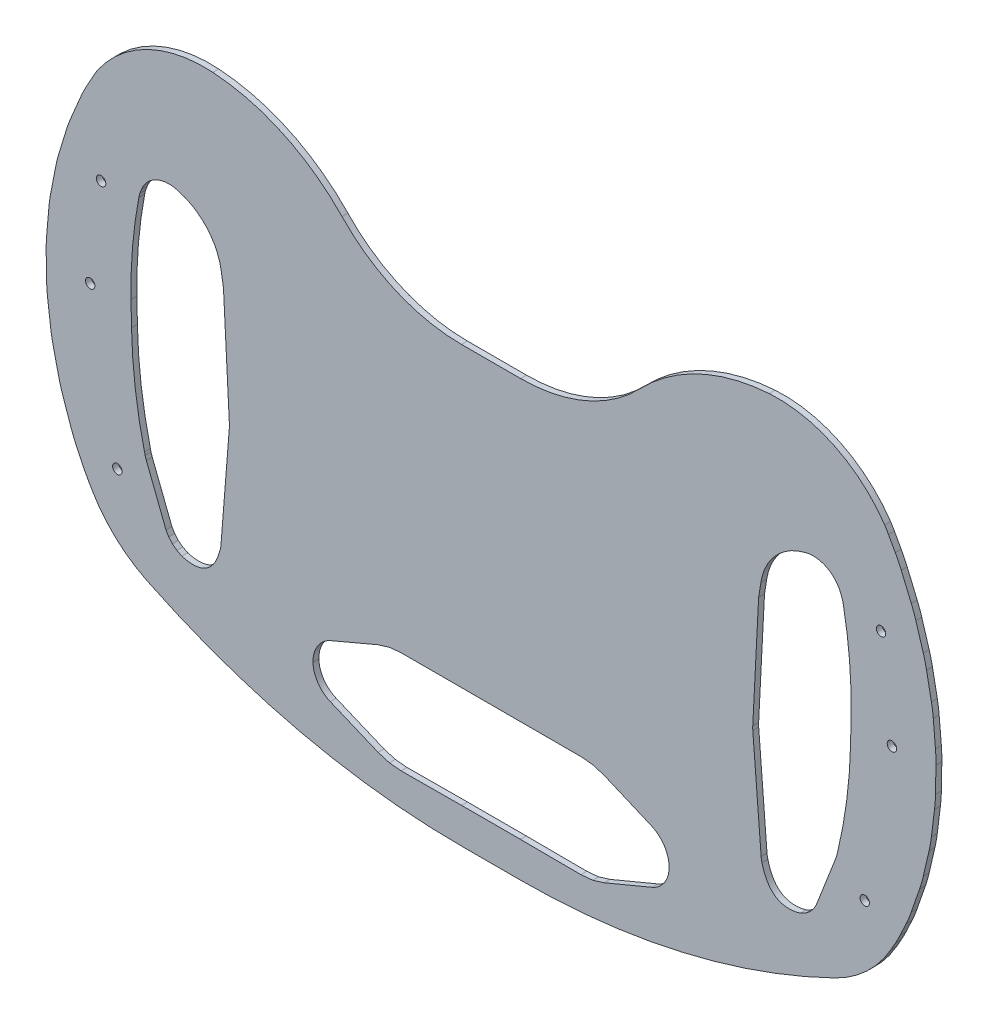
from build123d import *

# Parameters (mm, degrees)
SKETCH1_R           = 1.600004733
SKETCH1_R_2         = 1.600008458
SKETCH1_R_3         = 1.600001007
BOSS_EXTRUDE1_DEPTH = 2


with BuildPart() as part:
    # Sketch1 → Boss-Extrude1 (new body)
    with BuildSketch(Plane(origin=(0, 0, 3.49999997), x_dir=(-1, 0, 0), z_dir=(0, 0, -1))):
        with BuildLine():
            Line((-20, -102.64135196), (0, -102.64135196))
            ThreePointArc((0, -102.64135196), (54.826762958, -96.402803145), (106.850367414, -78.006118468))
            ThreePointArc((106.850367414, -78.006118468), (117.721514816, -70.507303457), (125.877694674, -60.120253705))
            Line((125.877694674, -60.120253705), (127.430048958, -57.377443185))
            ThreePointArc((127.430048958, -57.377443185), (128.246970558, -55.865942841), (129.004258673, -54.323701322))
            Line((129.004258673, -54.323701322), (131.011852014, -50.025012538))
            ThreePointArc((131.011852014, -50.025012538), (131.934514731, -47.905941493), (132.744632644, -45.741345098))
            Line((132.744632644, -45.741345098), (135.592695073, -37.476432501))
            ThreePointArc((135.592695073, -37.476432501), (136.284091675, -35.286016159), (136.86023823, -33.062503586))
            Line((136.86023823, -33.062503586), (138.815821901, -24.612835894))
            ThreePointArc((138.815821901, -24.612835894), (139.275226116, -22.361847038), (139.61651234, -20.089947662))
            Line((139.61651234, -20.089947662), (140.680309789, -11.484569813))
            ThreePointArc((140.680309789, -11.484569813), (140.902861597, -9.193521368), (141.005295113, -6.893969312))
            Line((141.005295113, -6.893969312), (141.164836348, 1.796846962))
            ThreePointArc((141.164836348, 1.796846962), (141.146870605, 4.098627751), (141.008553463, 6.396319188))
            Line((141.008553463, 6.396319188), (140.259460965, 15.056256593))
            ThreePointArc((140.259460965, 15.056256593), (140.001172695, 17.343557944), (139.62361976, 19.614221742))
            Line((139.62361976, 19.614221742), (137.974097204, 28.14852801))
            ThreePointArc((137.974097204, 28.14852801), (137.478304699, 30.396372901), (136.865634255, 32.61521309))
            Line((136.865634255, 32.61521309), (134.347453197, 40.885413673))
            ThreePointArc((134.347453197, 40.885413673), (133.622933873, 43.059929206), (132.786161536, 45.193765683))
            Line((132.786161536, 45.193765683), (129.38103378, 53.252929979))
            ThreePointArc((129.38103378, 53.252929979), (128.425728272, 55.357904754), (127.361191228, 57.40980346))
            Line((127.361191228, 57.40980346), (125.064933981, 61.565045915))
            ThreePointArc((125.064933981, 61.565045915), (124.417848961, 62.6960994), (123.737554881, 63.807495357))
            ThreePointArc((123.737554881, 63.807495357), (106.650553606, 78.494623558), (84.533580324, 82.797743379))
            ThreePointArc((84.533580324, 82.797743379), (60.673509561, 76.661567164), (40.645738515, 62.314301841))
            ThreePointArc((40.645738515, 62.314301841), (22.112560671, 49.500314192), (0.037401719, 44.987630099))
            Line((0.037401719, 44.987630099), (-20.037401719, 44.987630099))
            ThreePointArc((-20.037401719, 44.987630099), (-42.112560671, 49.500314192), (-60.645738515, 62.314301841))
            ThreePointArc((-60.645738515, 62.314301841), (-80.673509561, 76.661567164), (-104.533580324, 82.797743379))
            ThreePointArc((-104.533580324, 82.797743379), (-126.650553606, 78.494623558), (-143.737554881, 63.807495357))
            ThreePointArc((-143.737554881, 63.807495357), (-144.417848961, 62.6960994), (-145.064933981, 61.565045915))
            Line((-145.064933981, 61.565045915), (-147.361191228, 57.40980346))
            ThreePointArc((-147.361191228, 57.40980346), (-148.425728272, 55.357904754), (-149.38103378, 53.252929979))
            Line((-149.38103378, 53.252929979), (-152.786161536, 45.193765683))
            ThreePointArc((-152.786161536, 45.193765683), (-153.622933873, 43.059929206), (-154.347453197, 40.885413673))
            Line((-154.347453197, 40.885413673), (-156.865634255, 32.61521309))
            ThreePointArc((-156.865634255, 32.61521309), (-157.478304699, 30.396372901), (-157.974097204, 28.14852801))
            Line((-157.974097204, 28.14852801), (-159.62361976, 19.614221742))
            ThreePointArc((-159.62361976, 19.614221742), (-160.001172695, 17.343557944), (-160.259460965, 15.056256593))
            Line((-160.259460965, 15.056256593), (-161.008553463, 6.396319188))
            ThreePointArc((-161.008553463, 6.396319188), (-161.146870605, 4.098627751), (-161.164836348, 1.796846962))
            Line((-161.164836348, 1.796846962), (-161.005295113, -6.893969312))
            ThreePointArc((-161.005295113, -6.893969312), (-160.902861597, -9.193521368), (-160.680309789, -11.484569813))
            Line((-160.680309789, -11.484569813), (-159.61651234, -20.089947662))
            ThreePointArc((-159.61651234, -20.089947662), (-159.275226116, -22.361847038), (-158.815821901, -24.612835894))
            Line((-158.815821901, -24.612835894), (-156.86023823, -33.062503586))
            ThreePointArc((-156.86023823, -33.062503586), (-156.284091675, -35.286016159), (-155.592695073, -37.476432501))
            Line((-155.592695073, -37.476432501), (-152.744632644, -45.741345098))
            ThreePointArc((-152.744632644, -45.741345098), (-151.934514731, -47.905941493), (-151.011852014, -50.025012538))
            Line((-151.011852014, -50.025012538), (-149.004258673, -54.323701322))
            ThreePointArc((-149.004258673, -54.323701322), (-148.246970558, -55.865942841), (-147.430048958, -57.377443185))
            Line((-147.430048958, -57.377443185), (-145.877694674, -60.120253705))
            ThreePointArc((-145.877694674, -60.120253705), (-137.721514816, -70.507303457), (-126.850367414, -78.006118468))
            ThreePointArc((-126.850367414, -78.006118468), (-74.826762958, -96.402803145), (-20, -102.64135196))
        make_face()
        with Locations(Location((122.507877648, 31.873617321, 0), (0, 0, 180))):
            Circle(SKETCH1_R, mode=Mode.SUBTRACT)
        with Locations(Location((126.213986427, -0.126386527, 0), (0, 0, 180))):
            Circle(SKETCH1_R_2, mode=Mode.SUBTRACT)
        with Locations(Location((116.981077939, -50.126478076, 0), (0, 0, 180))):
            Circle(SKETCH1_R_3, mode=Mode.SUBTRACT)
        with Locations(Location((-142.507877648, 31.873617321, 0), (0, 0, 180))):
            Circle(SKETCH1_R, mode=Mode.SUBTRACT)
        with Locations(Location((-146.213986427, -0.126386527, 0), (0, 0, 180))):
            Circle(SKETCH1_R_2, mode=Mode.SUBTRACT)
        with Locations(Location((-136.981077939, -50.126478076, 0), (0, 0, 180))):
            Circle(SKETCH1_R_3, mode=Mode.SUBTRACT)
        with BuildLine():
            Line((44.633883222, -82.421982799), (28.371804087, -89.214366231))
            Line((28.371804087, -89.214366231), (24.538045485, -90.380866648))
            Line((24.538045485, -90.380866648), (20.547800836, -90.759357429))
            Line((20.547800836, -90.759357429), (0, -90.64135196))
            Line((0, -90.64135196), (-20, -90.64135196))
            Line((-20, -90.64135196), (-40.547800836, -90.759357429))
            Line((-40.547800836, -90.759357429), (-44.538045485, -90.380866648))
            Line((-44.538045485, -90.380866648), (-48.371804087, -89.214366231))
            Line((-48.371804087, -89.214366231), (-64.633883222, -82.421982799))
            ThreePointArc((-64.633883222, -82.421982799), (-68.851665981, -78.977873736), (-70.501508826, -73.788500245))
            ThreePointArc((-70.501508826, -73.788500245), (-70.501961618, -73.763472393), (-70.502383085, -73.738443994))
            ThreePointArc((-70.502383085, -73.738443994), (-68.886948973, -68.124624354), (-64.410763876, -64.371177232))
            Line((-64.410763876, -64.371177232), (-48.462577611, -57.602073997))
            Line((-48.462577611, -57.602073997), (-44.6355813, -56.413576007))
            Line((-44.6355813, -56.413576007), (-40.647576079, -56.012175977))
            Line((-40.647576079, -56.012175977), (20.647576079, -56.012175977))
            Line((20.647576079, -56.012175977), (24.6355813, -56.413576007))
            Line((24.6355813, -56.413576007), (28.462577611, -57.602073997))
            Line((28.462577611, -57.602073997), (44.410763876, -64.371177232))
            ThreePointArc((44.410763876, -64.371177232), (48.886948973, -68.124624354), (50.502383085, -73.738443994))
            ThreePointArc((50.502383085, -73.738443994), (50.501961618, -73.763472393), (50.501508826, -73.788500245))
            ThreePointArc((50.501508826, -73.788500245), (48.851665981, -78.977873736), (44.633883222, -82.421982799))
        make_face(mode=Mode.SUBTRACT)
        with BuildLine():
            Line((112.330870392, 2.008193919), (112.169496221, -6.17720884))
            ThreePointArc((112.169496221, -6.17720884), (110.892523408, -23.440775319), (107.757978426, -40.465346236))
            Line((107.757978426, -40.465346236), (107.533077653, -41.399726568))
            ThreePointArc((107.533077653, -41.399726568), (107.351568838, -42.055035972), (107.125945534, -42.696495239))
            Line((107.125945534, -42.696495239), (100.452773273, -59.788573533))
            Line((100.452773273, -59.788573533), (99.493771791, -61.407677829))
            Line((99.493771791, -61.407677829), (98.249576986, -62.818877399))
            Line((98.249576986, -62.818877399), (96.762277186, -63.972175121))
            Line((96.762277186, -63.972175121), (95.085576177, -64.825676382))
            add(Edge.make_bspline(
                [(95.085576177, -64.825676382), (88.312025213, -66.758417494), (83.965214614, -63.969601877), (82.04514438, -56.45922953)],
                knots=[0, 0, 0, 0, 1, 1, 1, 1], degree=3))
            ThreePointArc((82.04514438, -56.45922953), (81.868931385, -55.62230847), (81.764876801, -54.773391205))
            Line((81.764876801, -54.773391205), (78.93494376, -19.111380398))
            ThreePointArc((78.93494376, -19.111380398), (78.904575446, -18.459552266), (78.916783219, -17.807131298))
            Line((78.916783219, -17.807131298), (80.908394643, 20.949956745))
            Line((80.908394643, 20.949956745), (81.679197131, 25.811073766))
            ThreePointArc((81.679197131, 25.811073766), (86.570645848, 36.062773688), (96.255892095, 41.997386313))
            Line((96.255892095, 41.997386313), (96.92654592, 42.177092669))
            ThreePointArc((96.92654592, 42.177092669), (103.998645018, 41.456264112), (108.804873022, 36.218482919))
            ThreePointArc((108.804873022, 36.218482919), (109.063442875, 35.543245907), (109.305126974, 34.861782638))
            ThreePointArc((109.305126974, 34.861782638), (109.509516854, 34.186433218), (109.665774911, 33.498352204))
            Line((109.665774911, 33.498352204), (109.681650993, 33.414910346))
            ThreePointArc((109.681650993, 33.414910346), (111.822510129, 17.780404407), (112.330870392, 2.008193919))
        make_face(mode=Mode.SUBTRACT)
        with BuildLine():
            Line((-129.681650993, 33.414910346), (-129.665774911, 33.498352204))
            ThreePointArc((-129.665774911, 33.498352204), (-129.509516854, 34.186433218), (-129.305126974, 34.861782638))
            ThreePointArc((-129.305126974, 34.861782638), (-129.063442875, 35.543245907), (-128.804873022, 36.218482919))
            ThreePointArc((-128.804873022, 36.218482919), (-123.998645018, 41.456264112), (-116.92654592, 42.177092669))
            Line((-116.92654592, 42.177092669), (-116.255892095, 41.997386313))
            ThreePointArc((-116.255892095, 41.997386313), (-106.570645848, 36.062773688), (-101.679197131, 25.811073766))
            Line((-101.679197131, 25.811073766), (-100.908394643, 20.949956745))
            Line((-100.908394643, 20.949956745), (-98.916783219, -17.807131298))
            ThreePointArc((-98.916783219, -17.807131298), (-98.904575446, -18.459552266), (-98.93494376, -19.111380398))
            Line((-98.93494376, -19.111380398), (-101.764876801, -54.773391205))
            ThreePointArc((-101.764876801, -54.773391205), (-101.868931385, -55.62230847), (-102.04514438, -56.45922953))
            add(Edge.make_bspline(
                [(-115.085576177, -64.825676382), (-108.312025213, -66.758417494), (-103.965214614, -63.969601877), (-102.04514438, -56.45922953)],
                knots=[0, 0, 0, 0, 1, 1, 1, 1], degree=3))
            Line((-115.085576177, -64.825676382), (-116.762277186, -63.972175121))
            Line((-116.762277186, -63.972175121), (-118.249576986, -62.818877399))
            Line((-118.249576986, -62.818877399), (-119.493771791, -61.407677829))
            Line((-119.493771791, -61.407677829), (-120.452773273, -59.788573533))
            Line((-120.452773273, -59.788573533), (-127.125945534, -42.696495239))
            ThreePointArc((-127.125945534, -42.696495239), (-127.351568838, -42.055035972), (-127.533077653, -41.399726568))
            Line((-127.533077653, -41.399726568), (-127.757978426, -40.465346236))
            ThreePointArc((-127.757978426, -40.465346236), (-130.892523408, -23.440775319), (-132.169496221, -6.17720884))
            Line((-132.169496221, -6.17720884), (-132.330870392, 2.008193919))
            ThreePointArc((-132.330870392, 2.008193919), (-131.822510129, 17.780404407), (-129.681650993, 33.414910346))
        make_face(mode=Mode.SUBTRACT)
    extrude(amount=-BOSS_EXTRUDE1_DEPTH)


solid = part.part
